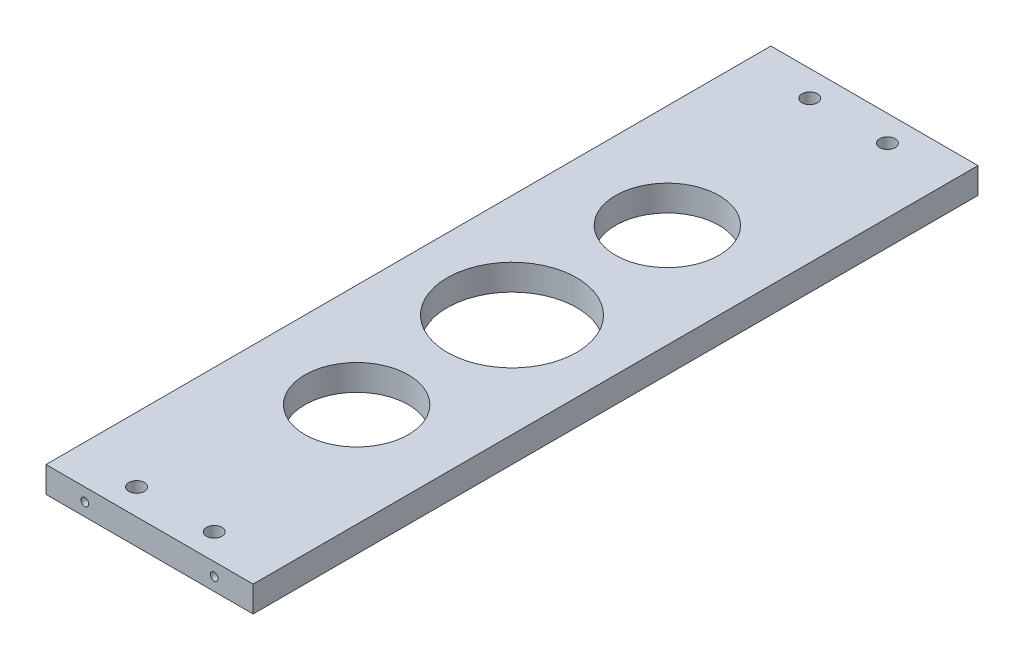
from build123d import *

# Parameters (mm, degrees)
SKETCH1_R           = 3
SKETCH1_R_2         = 25
SKETCH1_R_3         = 20
BOSS_EXTRUDE1_DEPTH = 10
SKETCH2_R           = 1.5
CUT_EXTRUDE1_DEPTH  = 15


with BuildPart() as part:
    # Sketch1 → Boss-Extrude1 (new body)
    with BuildSketch(Plane(origin=(0, 0, 0), x_dir=(1, 0, 0), z_dir=(0, 1, 0))):
        Polygon((0, -110), (0, 110), (0, 140), (80, 140), (80, 110), (80, -110), (80, -140), (0, -140), align=None)
        with Locations(Location((25, 130, 0), (0, 0, 270))):
            Circle(SKETCH1_R, mode=Mode.SUBTRACT)
        with Locations(Location((55, 130, 0), (0, 0, 270))):
            Circle(SKETCH1_R, mode=Mode.SUBTRACT)
        with Locations(Location((25, -130, 0), (0, 0, 270))):
            Circle(SKETCH1_R, mode=Mode.SUBTRACT)
        with Locations(Location((55, -130, 0), (0, 0, 270))):
            Circle(SKETCH1_R, mode=Mode.SUBTRACT)
        with Locations(Location((40, 0, 0), (0, 0, 270))):
            Circle(SKETCH1_R_2, mode=Mode.SUBTRACT)
        with Locations(Location((40, -60, 0), (0, 0, 270))):
            Circle(SKETCH1_R_3, mode=Mode.SUBTRACT)
        with Locations(Location((40, 60, 0), (0, 0, 270))):
            Circle(SKETCH1_R_3, mode=Mode.SUBTRACT)
    extrude(amount=BOSS_EXTRUDE1_DEPTH)

    # Sketch2 → Cut-Extrude1 (cut)
    with BuildSketch(Plane.XY.offset(140)):
        with Locations((15, 5)):
            Circle(SKETCH2_R)
        with Locations((65, 5)):
            Circle(SKETCH2_R)
    cut_extrude1 = extrude(amount=-CUT_EXTRUDE1_DEPTH, mode=Mode.SUBTRACT)

    # Mirror1: Cut-Extrude1 across plane
    add(cut_extrude1.mirror(Plane.XY), mode=Mode.SUBTRACT)


solid = part.part
